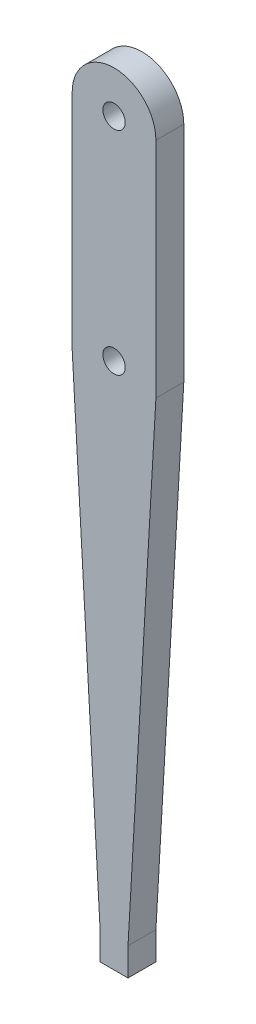
from build123d import *

# Parameters (mm, degrees)
CROQUIS1_R              = 2
SALIENTE_EXTRUIR5_DEPTH = 5


with BuildPart() as part:
    # Croquis1 → Saliente-Extruir5 (new body)
    with BuildSketch(Plane.XY):
        with BuildLine():
            Line((-7.5, -40), (-7.5, 0))
            ThreePointArc((-7.5, 0), (0, 7.5), (7.5, 0))
            Line((7.5, 0), (7.5, -40))
            Line((7.5, -40), (2.499716416, -127.5))
            Line((2.499716416, -127.5), (2.499716416, -132.5))
            Line((2.499716416, -132.5), (-2.499716416, -132.5))
            Line((-2.499716416, -132.5), (-2.499716416, -127.5))
            Line((-2.499716416, -127.5), (-7.5, -40))
        make_face()
        with Locations((0, -38)):
            Circle(CROQUIS1_R, mode=Mode.SUBTRACT)
        Circle(CROQUIS1_R, mode=Mode.SUBTRACT)
    extrude(amount=SALIENTE_EXTRUIR5_DEPTH)


solid = part.part
